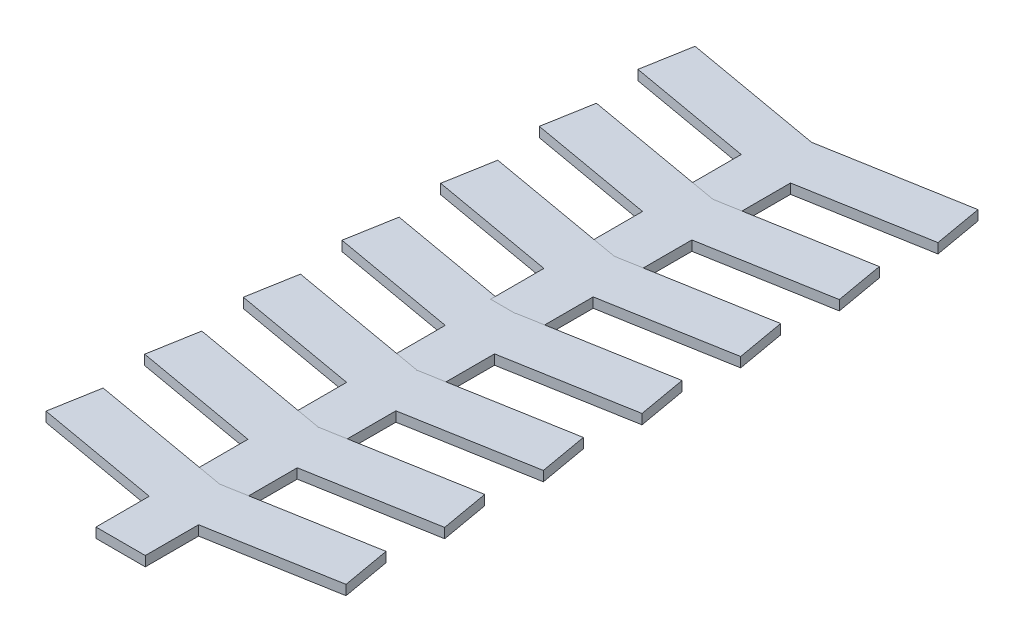
from build123d import *

# Parameters (mm, degrees)
BOSS_EXTRUDE1_DEPTH = 2
LPATTERN5_COUNT     = 7
LPATTERN5_PITCH     = 20


with BuildPart() as part:
    # Sketch1 → Boss-Extrude1 (new body)
    with BuildSketch(Plane(origin=(0, 0, 0), x_dir=(1, 0, 0), z_dir=(0, 1, 0))):
        Polygon((-28.675991702, 10.133484095), (0, 5.077133059), (28.675991702, 10.133484095), (30.412473479, 0.285406565), (5, -4.195498156), (5, -15), (-5, -15), (-5, -4.195498156), (-30.412473479, 0.285406565), align=None)
    extrude(amount=BOSS_EXTRUDE1_DEPTH)


with BuildPart() as lpattern5_1:
    # LPattern5: pattern copy
    add(part.part.moved(Location(Vector(0, 0, 1) * (1 * LPATTERN5_PITCH))))


with BuildPart() as lpattern5_2:
    # LPattern5: pattern copy
    add(part.part.moved(Location(Vector(0, 0, 1) * (2 * LPATTERN5_PITCH))))


with BuildPart() as lpattern5_3:
    # LPattern5: pattern copy
    add(part.part.moved(Location(Vector(0, 0, 1) * (3 * LPATTERN5_PITCH))))


with BuildPart() as lpattern5_4:
    # LPattern5: pattern copy
    add(part.part.moved(Location(Vector(0, 0, 1) * (4 * LPATTERN5_PITCH))))


with BuildPart() as lpattern5_5:
    # LPattern5: pattern copy
    add(part.part.moved(Location(Vector(0, 0, 1) * (5 * LPATTERN5_PITCH))))


with BuildPart() as lpattern5_6:
    # LPattern5: pattern copy
    add(part.part.moved(Location(Vector(0, 0, 1) * (6 * LPATTERN5_PITCH))))


solid = Compound([part.part, lpattern5_1.part, lpattern5_2.part, lpattern5_3.part, lpattern5_4.part, lpattern5_5.part, lpattern5_6.part])
